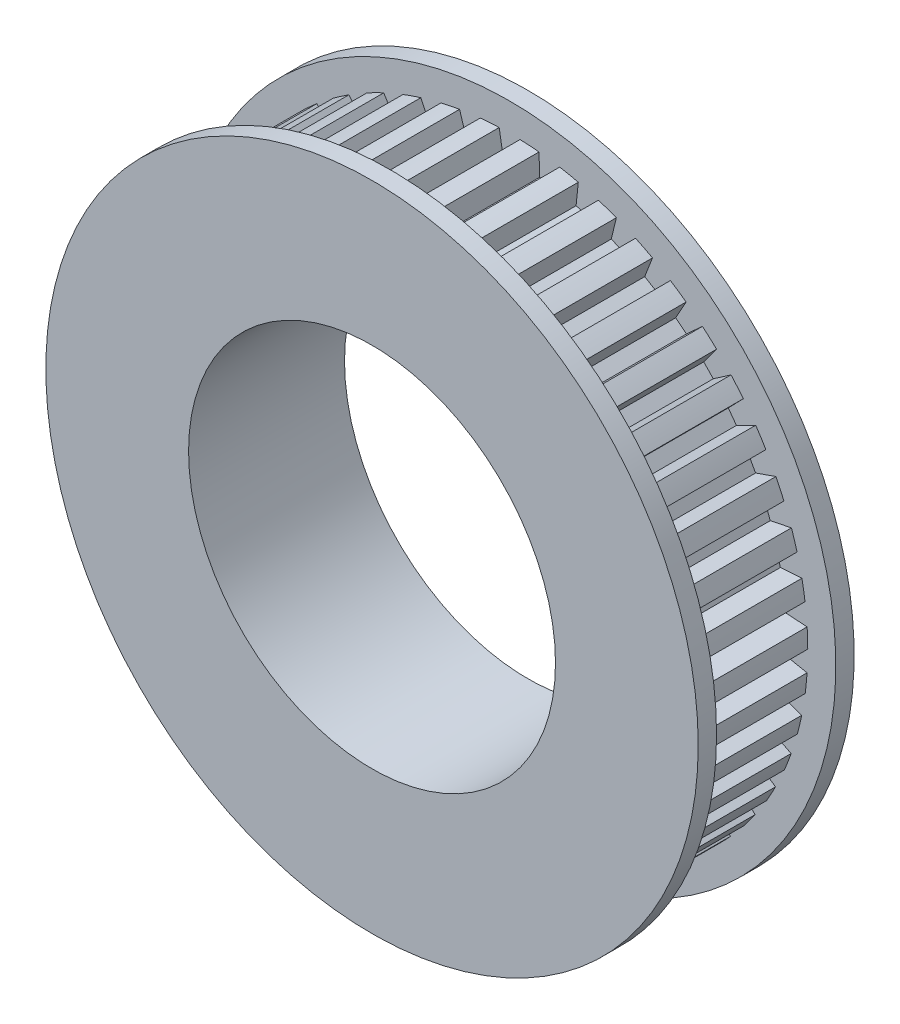
from build123d import *

# Parameters (mm, degrees)
SKETCH3_R               = 16.25
BOSS_EXTRUDE2_DEPTH     = 3.25
CUT_EXTRUDE2_DEPTH      = 24.209642393
CIRPATTERN3_COUNT       = 47
SKETCH5_R               = 17.78
BOSS_EXTRUDE3_DEPTH     = 1
BOSS_EXTRUDE4_START     = 1
SKETCH6_R               = 17.78
BOSS_EXTRUDE4_DEPTH     = 1
CUT_EXTRUDE3_DEPTH      = 27.542546977
CUT_EXTRUDE3_DEPTH_BACK = 27.542546977
SKETCH7_R               = 10


with BuildPart() as part:
    # Sketch3 → Boss-Extrude2 (new, symmetric)
    with BuildSketch(Plane.XY):
        with Locations(Location((0, 0, 0), (0, 0, 180))):
            Circle(SKETCH3_R)
    extrude(amount=BOSS_EXTRUDE2_DEPTH, both=True)

    # Sketch1 → Cut-Extrude2 (cut, symmetric)
    with BuildSketch(Plane.XY):
        Polygon((-0.375, 15.08), (0.375, 15.08), (0.654345854, 16.756075122), (-0.654345854, 16.756075122), align=None)
    cut_extrude2 = extrude(amount=CUT_EXTRUDE2_DEPTH, both=True, mode=Mode.SUBTRACT)

    # CirPattern3: Cut-Extrude2 ×47 about axis
    cirpattern3_axis = Axis((0, 0, 0), (0, 0, 1))
    for i in range(1, CIRPATTERN3_COUNT):
        add(cut_extrude2.rotate(cirpattern3_axis, i * 360 / CIRPATTERN3_COUNT), mode=Mode.SUBTRACT)

    # Sketch5 → Boss-Extrude3 (add)
    with BuildSketch(Plane(origin=(0, 0, -3.25), x_dir=(-1, 0, 0), z_dir=(0, 0, -1))):
        Circle(SKETCH5_R)
    extrude(amount=BOSS_EXTRUDE3_DEPTH)

    # Sketch6 → Boss-Extrude4 (add)
    with BuildSketch(Plane.XY.offset(3.25).offset(BOSS_EXTRUDE4_START)):
        with Locations(Location((0, 0, 0), (0, 0, 180))):
            Circle(SKETCH6_R)
    extrude(amount=-BOSS_EXTRUDE4_DEPTH)

    # Sketch7 → Cut-Extrude3 (cut, two sides: drawn at the far end of the back side and taken through both)
    with BuildSketch(Plane.XY.offset(4.25).offset(-CUT_EXTRUDE3_DEPTH_BACK)):
        Circle(SKETCH7_R)
    extrude(amount=CUT_EXTRUDE3_DEPTH + CUT_EXTRUDE3_DEPTH_BACK, mode=Mode.SUBTRACT)


solid = part.part
